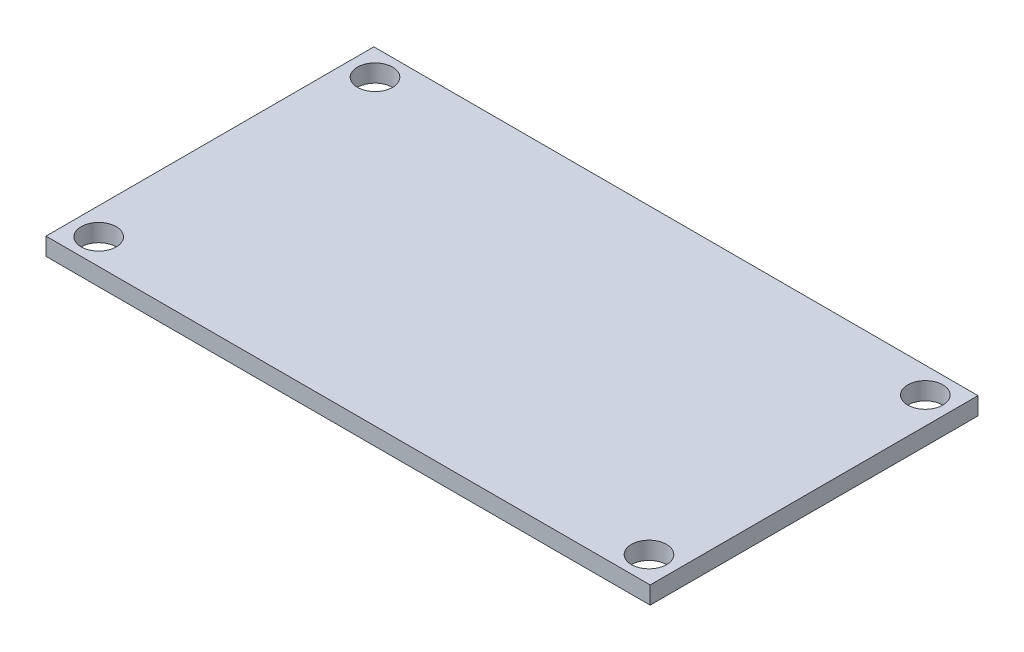
from build123d import *

# Parameters (mm, degrees)
SKETCH1_W           = 51.6
SKETCH1_H           = 28
BOSS_EXTRUDE1_DEPTH = 1.5
SKETCH2_R           = 1.5
CUT_EXTRUDE1_DEPTH  = 1.5


with BuildPart() as part:
    # Sketch1 → Boss-Extrude1 (new body)
    with BuildSketch(Plane(origin=(0, 0, 0), x_dir=(1, 0, 0), z_dir=(0, 1, 0))):
        with Locations((25.8, -14)):
            Rectangle(SKETCH1_W, SKETCH1_H)
    extrude(amount=BOSS_EXTRUDE1_DEPTH)

    # Sketch2 → Cut-Extrude1 (cut)
    with BuildSketch(Plane(origin=(0, 1.5, 0), x_dir=(1, 0, 0), z_dir=(0, 1, 0))):
        with Locations(Location((2.3, -2.2, 0), (0, 0, 270))):
            Circle(SKETCH2_R)
        with Locations(Location((49.3, -2.2, 0), (0, 0, 270))):
            Circle(SKETCH2_R)
        with Locations(Location((49.3, -25.8, 0), (0, 0, 270))):
            Circle(SKETCH2_R)
        with Locations(Location((2.3, -25.8, 0), (0, 0, 270))):
            Circle(SKETCH2_R)
    extrude(amount=-CUT_EXTRUDE1_DEPTH, mode=Mode.SUBTRACT)


solid = part.part
